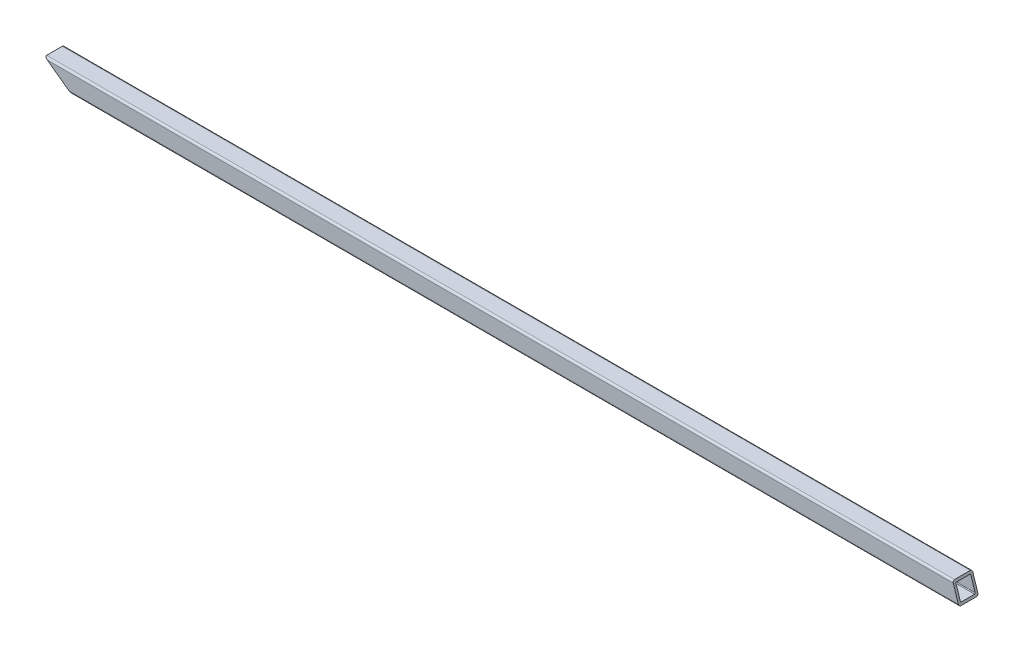
from build123d import *

# Parameters (mm, degrees)
SKETCH3_W           = 25.4
SKETCH3_H           = 25.4
SKETCH3_W_2         = 19.304
SKETCH3_H_2         = 19.304
BOSS_EXTRUDE1_DEPTH = 1190.03
FILLET1_R           = 2.5
FILLET2_R           = 1
CUT_EXTRUDE1_DEPTH  = 1191.368787771


with BuildPart() as part:
    # Sketch3 → Boss-Extrude1 (new body)
    with BuildSketch(Plane(origin=(0, 0, 0), x_dir=(0, 0, -1), z_dir=(1, 0, 0))):
        Rectangle(SKETCH3_W, SKETCH3_H)
        Rectangle(SKETCH3_W_2, SKETCH3_H_2, mode=Mode.SUBTRACT)
    extrude(amount=-BOSS_EXTRUDE1_DEPTH)

    # Fillet1
    fillet1_edges = [part.edges().sort_by_distance(p)[0] for p in [
        (-595.015, -12.7, -12.7),
        (-595.015, -12.7, 12.7),
        (-595.015, 12.7, 12.7),
        (-595.015, 12.7, -12.7),
    ]]
    fillet(fillet1_edges, radius=FILLET1_R)

    # Fillet2
    fillet2_edges = [part.edges().sort_by_distance(p)[0] for p in [
        (-595.015, 9.652, -9.652),
        (-595.015, -9.652, -9.652),
        (-595.015, -9.652, 9.652),
        (-595.015, 9.652, 9.652),
    ]]
    fillet(fillet2_edges, radius=FILLET2_R)

    # Sketch5 → Cut-Extrude1 (cut, through all)
    with BuildSketch(Plane(origin=(0, 0, -12.7), x_dir=(-1, 0, 0), z_dir=(0, 0, -1))):
        Polygon((1190.03, 12.7), (1155.06989922, -12.7), (1190.03, -12.7), align=None)
        Polygon((0, 12.7), (8.252960284, 12.7), (0, -12.7), align=None)
    extrude(amount=-CUT_EXTRUDE1_DEPTH, mode=Mode.SUBTRACT)


solid = part.part
